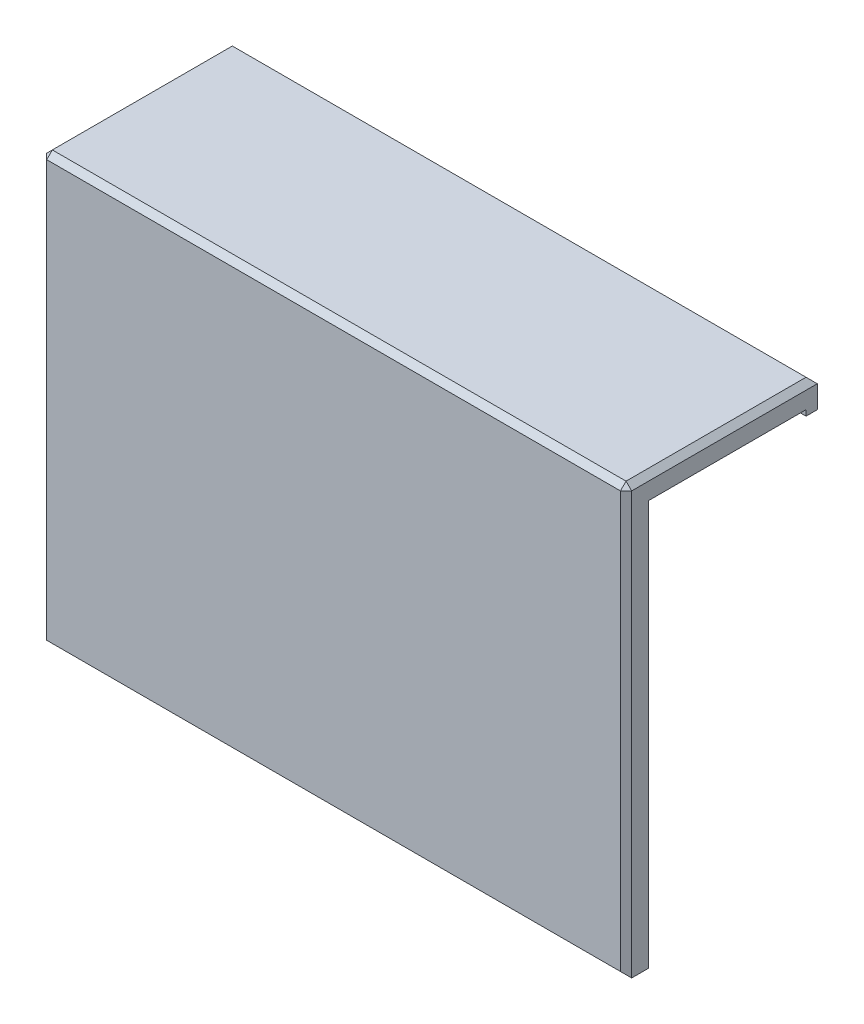
from build123d import *

# Parameters (mm, degrees)
SKETCH1_W               = 104
SKETCH1_H               = 74
BOSS_EXTRUDE1_DEPTH     = 1
BOSS_EXTRUDE2_DEPTH     = 3
BOSS_EXTRUDE3_DEPTH     = 28
SKETCH3_W               = 104
SKETCH3_H               = 4
BOSS_EXTRUDE4_DEPTH     = 2
CUT_EXTRUDE1_DEPTH      = 11
CUT_EXTRUDE1_DEPTH_BACK = 11
CUT_EXTRUDE1_START      = -52
SKETCH5_W               = 104
SKETCH5_H               = 5
BOSS_EXTRUDE6_DEPTH     = 2
CUT_EXTRUDE2_START      = -32
CUT_EXTRUDE2_DEPTH      = 11
CUT_EXTRUDE3_START      = -83
CUT_EXTRUDE3_DEPTH      = 11
CHAMFER2_SIZE           = 1


with BuildPart() as part:
    # Sketch1 → Boss-Extrude1 (new body)
    with BuildSketch(Plane.XY):
        with Locations((50, 37)):
            Rectangle(SKETCH1_W, SKETCH1_H)
    extrude(amount=BOSS_EXTRUDE1_DEPTH)

    # Sketch1<3> → Boss-Extrude2 (add)
    with BuildSketch(Plane.XY):
        Polygon((-2, 74), (-2, 0), (0, 0), (0, 72), (100, 72), (100, 0), (102, 0), (102, 74), align=None)
    extrude(amount=-BOSS_EXTRUDE2_DEPTH)

    # Sketch2 → Boss-Extrude3 (add)
    with BuildSketch(Plane(origin=(0, 0, -3), x_dir=(-1, 0, 0), z_dir=(0, 0, -1))):
        Polygon((-102, 74), (2, 74), (2, 70), (0, 70), (0, 72), (-100, 72), (-100, 70), (-102, 70), align=None)
    extrude(amount=BOSS_EXTRUDE3_DEPTH)

    # Sketch3 → Boss-Extrude4 (add)
    with BuildSketch(Plane.XZ):
        with Locations((50, -1)):
            Rectangle(SKETCH3_W, SKETCH3_H)
    extrude(amount=BOSS_EXTRUDE4_DEPTH)

    # Sketch4 → Cut-Extrude1 (cut, two sides: drawn at the far end of the back side and taken through both)
    with BuildSketch(Plane.ZY.offset(2).offset(CUT_EXTRUDE1_START - CUT_EXTRUDE1_DEPTH_BACK)):
        with BuildLine():
            Line((0.2, 0), (-2.2, 0))
            ThreePointArc((-2.2, 0), (-1, -1.2), (0.2, 0))
        make_face()
    extrude(amount=CUT_EXTRUDE1_DEPTH + CUT_EXTRUDE1_DEPTH_BACK, mode=Mode.SUBTRACT)

    # Sketch5 → Boss-Extrude6 (add)
    with BuildSketch(Plane(origin=(0, 0, -31), x_dir=(-1, 0, 0), z_dir=(0, 0, -1))):
        with Locations((-50, 71.5)):
            Rectangle(SKETCH5_W, SKETCH5_H)
    extrude(amount=BOSS_EXTRUDE6_DEPTH)

    # Sketch6 → Cut-Extrude2 (cut)
    with BuildSketch(Plane.ZY.offset(2).offset(CUT_EXTRUDE2_START)):
        with BuildLine():
            ThreePointArc((-31, 72.2), (-32.2, 71), (-31, 69.8))
            Line((-31, 69.8), (-31, 72.2))
        make_face()
    extrude(amount=CUT_EXTRUDE2_DEPTH, mode=Mode.SUBTRACT)

    # Sketch6<3> → Cut-Extrude3 (cut)
    with BuildSketch(Plane.ZY.offset(2).offset(CUT_EXTRUDE3_START)):
        with BuildLine():
            ThreePointArc((-31, 72.2), (-32.2, 71), (-31, 69.8))
            Line((-31, 69.8), (-31, 72.2))
        make_face()
    extrude(amount=CUT_EXTRUDE3_DEPTH, mode=Mode.SUBTRACT)

    # Chamfer2
    chamfer2_edges = [part.edges().sort_by_distance(p)[0] for p in [
        (50, 74, -33),
        (50, 74, 1),
        (-2, 74, -16),
        (-2, 36, 1),
        (50, -2, 1),
        (102, 36, 1),
        (102, 74, -16),
    ]]
    chamfer(chamfer2_edges, length=CHAMFER2_SIZE)


solid = part.part
